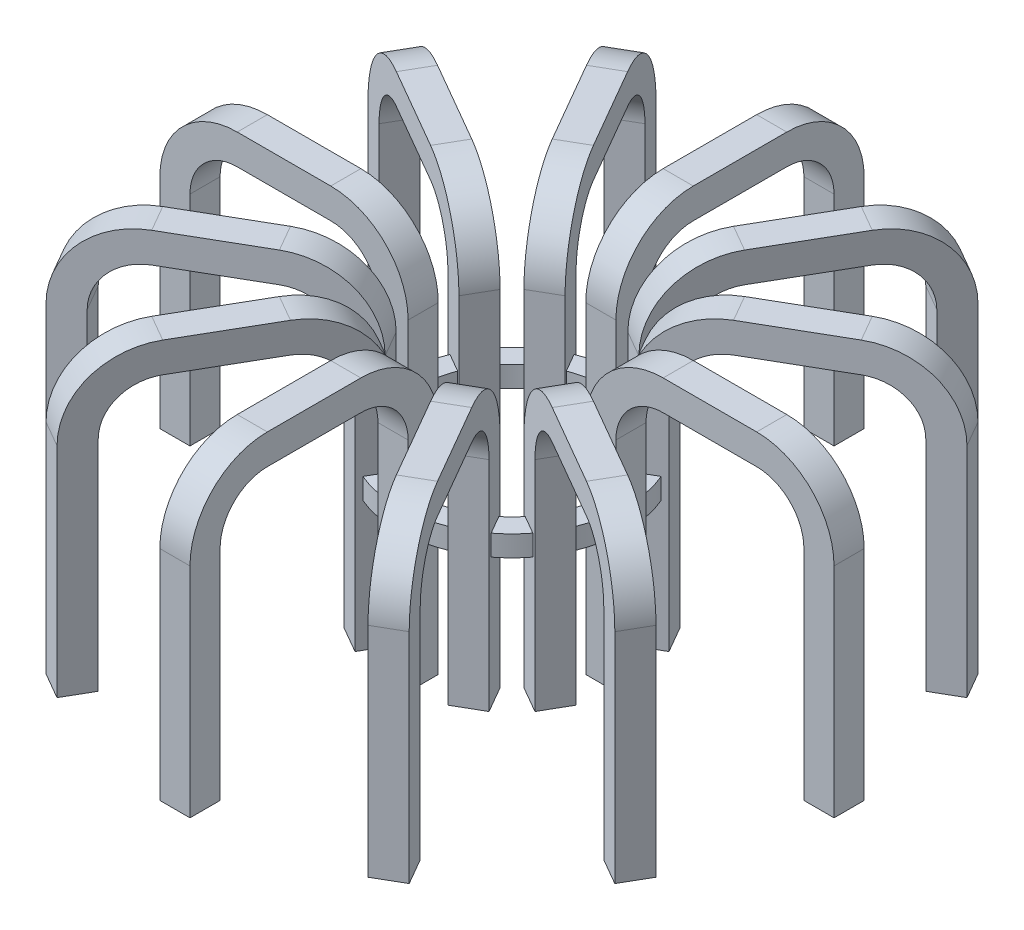
from build123d import *

# Parameters (mm, degrees)
SKETCH4_W         = 1.45
SKETCH4_H         = 1.45
SKETCH6_W         = 1
SKETCH6_H         = 1
CIRPATTERN2_COUNT = 12


with BuildPart() as part:
    # Sweep1: sweep along a path in Sketch3
    with BuildLine(Plane(origin=(0, 0, 0), x_dir=(0, 0, -1), z_dir=(1, 0, 0))) as sweep1_path:
        Line((10.25, 6.75), (12.5, 6.75))
        ThreePointArc((12.5, 6.75), (14.621320344, 5.871320344), (15.5, 3.75))
        Line((15.5, 3.75), (15.5, -6.75))
    # Sketch4 → Sweep1 (sweep)
    with BuildSketch(Plane.XY.offset(-10.25)):
        with Locations((0, 6.75)):
            Rectangle(SKETCH4_W, SKETCH4_H)
    sweep1 = sweep(path=sweep1_path.line)

    # Mirror1: Sweep1 across plane
    add(sweep1.mirror(Plane.XY.offset(-10.25)))


with BuildPart() as body_2:
    # Sketch6 → Revolve1 (revolve)
    with BuildSketch(Plane(origin=(0, 0, 0), x_dir=(0, 0, -1), z_dir=(1, 0, 0))):
        with Locations((5, 0)):
            Rectangle(SKETCH6_W, SKETCH6_H)
    revolve(axis=Axis((0, -3.602578218, 0), (0, 1, 0)))


with BuildPart() as cirpattern2_1:
    # CirPattern2: pattern copy
    add(part.part.rotate(Axis((0, -3.602578218, 0), (0, 1, 0)), 1 * 360 / CIRPATTERN2_COUNT))


with BuildPart() as cirpattern2_2:
    # CirPattern2: pattern copy
    add(part.part.rotate(Axis((0, -3.602578218, 0), (0, 1, 0)), 2 * 360 / CIRPATTERN2_COUNT))


with BuildPart() as cirpattern2_3:
    # CirPattern2: pattern copy
    add(part.part.rotate(Axis((0, -3.602578218, 0), (0, 1, 0)), 3 * 360 / CIRPATTERN2_COUNT))


with BuildPart() as cirpattern2_4:
    # CirPattern2: pattern copy
    add(part.part.rotate(Axis((0, -3.602578218, 0), (0, 1, 0)), 4 * 360 / CIRPATTERN2_COUNT))


with BuildPart() as cirpattern2_5:
    # CirPattern2: pattern copy
    add(part.part.rotate(Axis((0, -3.602578218, 0), (0, 1, 0)), 5 * 360 / CIRPATTERN2_COUNT))


with BuildPart() as cirpattern2_6:
    # CirPattern2: pattern copy
    add(part.part.rotate(Axis((0, -3.602578218, 0), (0, 1, 0)), 6 * 360 / CIRPATTERN2_COUNT))


with BuildPart() as cirpattern2_7:
    # CirPattern2: pattern copy
    add(part.part.rotate(Axis((0, -3.602578218, 0), (0, 1, 0)), 7 * 360 / CIRPATTERN2_COUNT))


with BuildPart() as cirpattern2_8:
    # CirPattern2: pattern copy
    add(part.part.rotate(Axis((0, -3.602578218, 0), (0, 1, 0)), 8 * 360 / CIRPATTERN2_COUNT))


with BuildPart() as cirpattern2_9:
    # CirPattern2: pattern copy
    add(part.part.rotate(Axis((0, -3.602578218, 0), (0, 1, 0)), 9 * 360 / CIRPATTERN2_COUNT))


with BuildPart() as cirpattern2_10:
    # CirPattern2: pattern copy
    add(part.part.rotate(Axis((0, -3.602578218, 0), (0, 1, 0)), 10 * 360 / CIRPATTERN2_COUNT))


with BuildPart() as cirpattern2_11:
    # CirPattern2: pattern copy
    add(part.part.rotate(Axis((0, -3.602578218, 0), (0, 1, 0)), 11 * 360 / CIRPATTERN2_COUNT))


with BuildPart() as part_1:
    add(part.part)

    # Combine1: union body 2, CirPattern2_1, CirPattern2_2, CirPattern2_3, CirPattern2_4, CirPattern2_5, CirPattern2_6, CirPattern2_7, CirPattern2_8, CirPattern2_9, CirPattern2_11, CirPattern2_10
    add(body_2.part)
    add(cirpattern2_1.part)
    add(cirpattern2_2.part)
    add(cirpattern2_3.part)
    add(cirpattern2_4.part)
    add(cirpattern2_5.part)
    add(cirpattern2_6.part)
    add(cirpattern2_7.part)
    add(cirpattern2_8.part)
    add(cirpattern2_9.part)
    add(cirpattern2_11.part)
    add(cirpattern2_10.part)


solid = part_1.part
